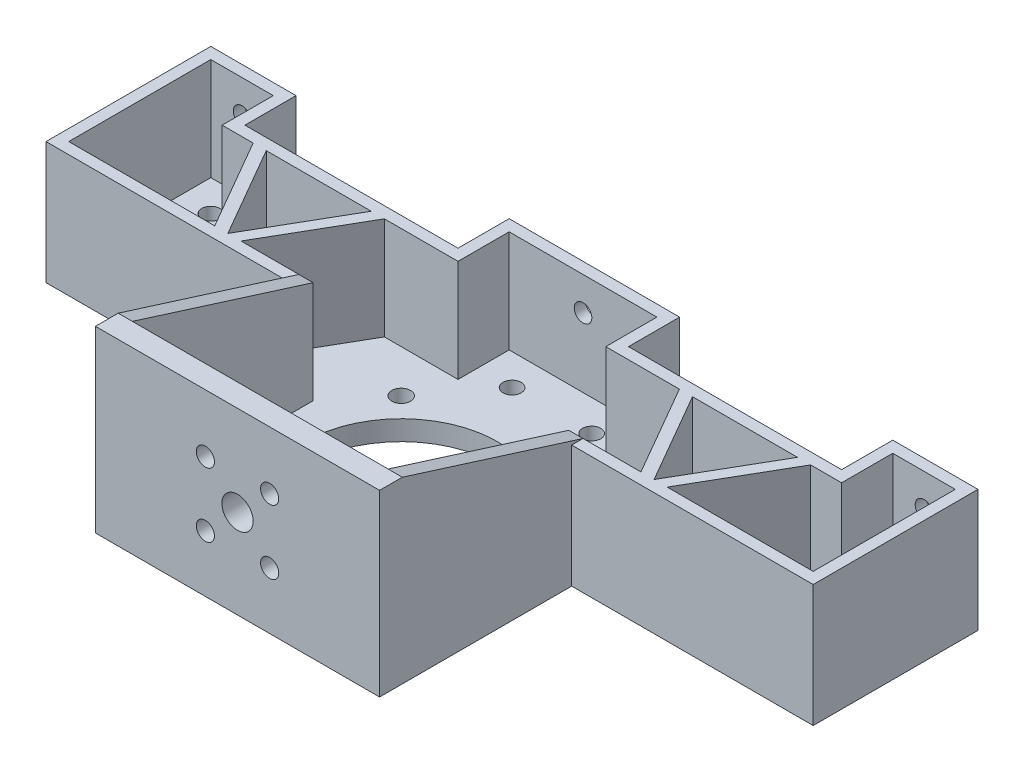
from build123d import *

# Parameters (mm, degrees)
SKETCH_2_R          = 1.6
SKETCH_2_R_2        = 17
SKETCH_2_R_3        = 1.65
EXTRUDE_2_DEPTH     = 3.5
EXTRUDE_3_DEPTH     = 18
EXTRUDE_4_DEPTH     = 10
CUT_EXTRUDE_5_DEPTH = 117.156532317
SKETCH_10_R         = 2.75
SKETCH_10_R_2       = 1.6
CUT_EXTRUDE_4_DEPTH = 5
EXTRUDE_5_DEPTH     = 18
SKETCH_14_R         = 1.55
CUT_EXTRUDE_6_DEPTH = 10


with BuildPart() as part:
    # 草图2 → 凸台-拉伸2 (new body)
    with BuildSketch(Plane(origin=(0, 0, 0), x_dir=(1, 0, 0), z_dir=(0, 1, 0))):
        Polygon((-42.5, 33.8), (-42.5, 62.8), (-27.5, 62.8), (-27.5, 53.8), (10, 53.8), (10, 62.8), (40, 62.8), (40, 53.8), (77.5, 53.8), (77.5, 62.8), (92.5, 62.8), (92.5, 33.8), (50, 33.8), (50, 0), (0, 0), (0, 33.8), align=None)
        with Locations(Location((-35, 55.312210178, 0), (0, 0, 270))):
            Circle(SKETCH_2_R, mode=Mode.SUBTRACT)
        with Locations(Location((85, 55.312210178, 0), (0, 0, 270))):
            Circle(SKETCH_2_R, mode=Mode.SUBTRACT)
        with Locations(Location((18, 55.312210178, 0), (0, 0, 270))):
            Circle(SKETCH_2_R, mode=Mode.SUBTRACT)
        with Locations(Location((32, 55.312210178, 0), (0, 0, 270))):
            Circle(SKETCH_2_R, mode=Mode.SUBTRACT)
        with Locations(Location((25, 28.8, 0), (0, 0, 270))):
            Circle(SKETCH_2_R_2, mode=Mode.SUBTRACT)
        with Locations(Location((40.5, 44.3, 0), (0, 0, 270))):
            Circle(SKETCH_2_R_3, mode=Mode.SUBTRACT)
        with Locations(Location((40.5, 13.3, 0), (0, 0, 270))):
            Circle(SKETCH_2_R_3, mode=Mode.SUBTRACT)
        with Locations(Location((9.5, 13.3, 0), (0, 0, 270))):
            Circle(SKETCH_2_R_3, mode=Mode.SUBTRACT)
        with Locations(Location((9.5, 44.3, 0), (0, 0, 270))):
            Circle(SKETCH_2_R_3, mode=Mode.SUBTRACT)
    extrude(amount=EXTRUDE_2_DEPTH)

    # 草图6 → 凸台-拉伸3 (add)
    with BuildSketch(Plane(origin=(0, 3.5, 0), x_dir=(1, 0, 0), z_dir=(0, 1, 0))):
        Polygon((10, 53.8), (-27.5, 53.8), (-27.5, 62.8), (-42.5, 62.8), (-42.5, 33.8), (0, 33.8), (0, 0), (50, 0), (50, 33.8), (92.5, 33.8), (92.5, 62.8), (77.5, 62.8), (77.5, 53.8), (40, 53.8), (40, 62.8), (10, 62.8), align=None)
        Polygon((12, 51.8), (-29.5, 51.8), (-29.5, 60.8), (-40.5, 60.8), (-40.5, 35.8), (2.5, 35.8), (2.5, 4), (47.5, 4), (47.5, 35.8), (90.5, 35.8), (90.5, 60.8), (79.5, 60.8), (79.5, 51.8), (38, 51.8), (38, 60.8), (12, 60.8), align=None, mode=Mode.SUBTRACT)
    extrude(amount=EXTRUDE_3_DEPTH)

    # 草图11 → 凸台-拉伸4 (add)
    with BuildSketch(Plane(origin=(0, 21.5, 0), x_dir=(1, 0, 0), z_dir=(0, 1, 0))):
        Polygon((2.5, 35.8), (2.5, 4), (47.5, 4), (47.5, 35.8), (50, 35.8), (50, 0), (0, 0), (0, 35.8), align=None)
    extrude(amount=EXTRUDE_4_DEPTH)

    # 草图12 → 切除-拉伸5 (cut, through all)
    with BuildSketch(Plane.ZY):
        Polygon((-35.8, 21.5), (-4, 31.5), (-35.8, 31.5), align=None)
    extrude(amount=-CUT_EXTRUDE_5_DEPTH, mode=Mode.SUBTRACT)

    # 草图10 → 切除-拉伸4 (cut)
    with BuildSketch(Plane.XY):
        with Locations((25, 15.656854249)):
            Circle(SKETCH_10_R)
        with Locations((30.656854249, 21.313708499)):
            Circle(SKETCH_10_R_2)
        with Locations((30.656854249, 10)):
            Circle(SKETCH_10_R_2)
        with Locations((19.343145751, 10)):
            Circle(SKETCH_10_R_2)
        with Locations((19.343145751, 21.313708499)):
            Circle(SKETCH_10_R_2)
    extrude(amount=-CUT_EXTRUDE_4_DEPTH, mode=Mode.SUBTRACT)

    # 草图13 → 凸台-拉伸5 (add)
    with BuildSketch(Plane(origin=(0, 3.5, 0), x_dir=(1, 0, 0), z_dir=(0, 1, 0))):
        Polygon((-12.5, 35.8), (-21.737604307, 51.8), (-24.047005384, 51.8), (-14.809401077, 35.8), align=None)
        Polygon((-3.262395693, 51.8), (-12.5, 35.8), (-10.190598923, 35.8), (-0.952994616, 51.8), align=None)
        Polygon((50.952994616, 51.8), (60.190598923, 35.8), (62.5, 35.8), (53.262395693, 51.8), align=None)
        Polygon((71.737604307, 51.8), (62.5, 35.8), (64.809401077, 35.8), (74.047005384, 51.8), align=None)
    extrude(amount=EXTRUDE_5_DEPTH)

    # 草图14 → 切除-拉伸6 (cut)
    with BuildSketch(Plane(origin=(0, 0, -62.8), x_dir=(-1, 0, 0), z_dir=(0, 0, -1))):
        with Locations((35, 15.656854249)):
            Circle(SKETCH_14_R)
        with Locations(Location((-85, 15.656854249, 0), (0, 0, 180))):
            Circle(SKETCH_14_R)
        with Locations((-25, 15.656854249)):
            Circle(SKETCH_14_R)
    extrude(amount=-CUT_EXTRUDE_6_DEPTH, mode=Mode.SUBTRACT)


solid = part.part
